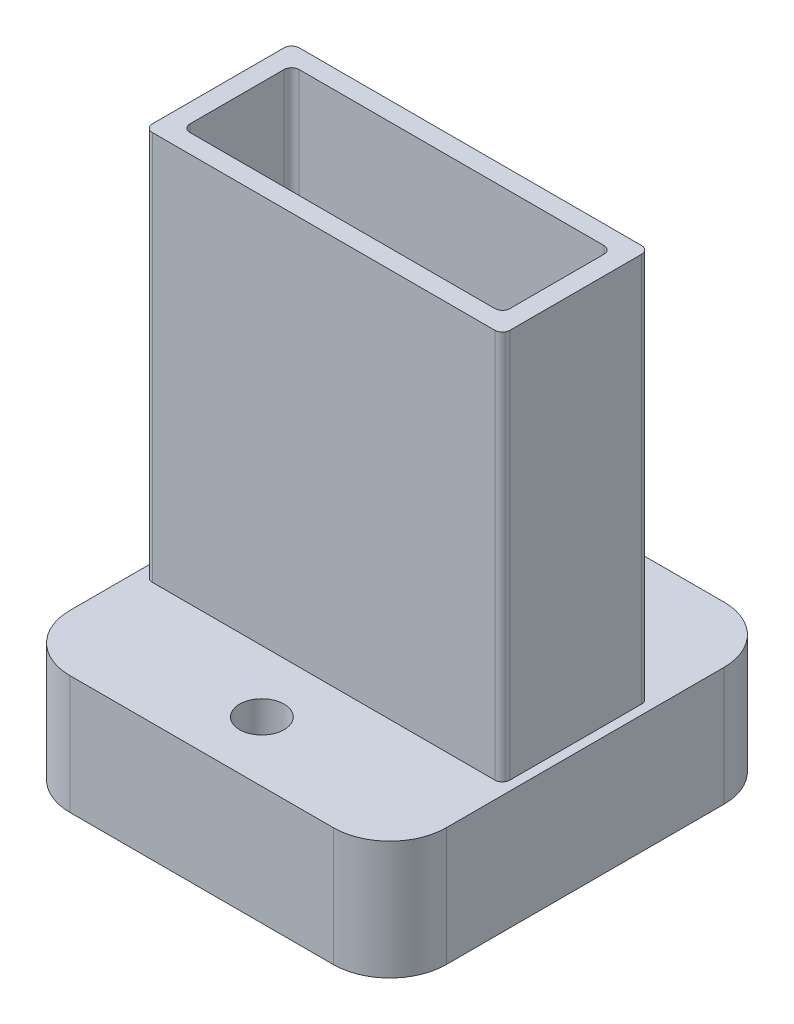
from build123d import *

# Parameters (mm, degrees)
BOSS_EXTRUDE1_DEPTH = 23.622
BOSS_EXTRUDE2_DEPTH = 10.668
SKETCH4_R           = 1.499997
BOSS_EXTRUDE3_DEPTH = 8


with BuildPart() as part:
    # Sketch1 → Boss-Extrude1 (new body)
    with BuildSketch(Plane(origin=(0, 0, 0), x_dir=(1, 0, 0), z_dir=(0, 1, 0))):
        with BuildLine():
            Line((11.557, 4.953), (-11.557, 4.953))
            ThreePointArc((-11.557, 4.953), (-11.916210245, 4.804210245), (-12.065, 4.445))
            Line((-12.065, 4.445), (-12.065, -4.445))
            ThreePointArc((-12.065, -4.445), (-11.916210245, -4.804210245), (-11.557, -4.953))
            Line((-11.557, -4.953), (11.557, -4.953))
            ThreePointArc((11.557, -4.953), (11.916210245, -4.804210245), (12.065, -4.445))
            Line((12.065, -4.445), (12.065, 4.445))
            ThreePointArc((12.065, 4.445), (11.916210245, 4.804210245), (11.557, 4.953))
        make_face()
    extrude(amount=BOSS_EXTRUDE1_DEPTH)

    # Sketch2 → Boss-Extrude2 (add)
    with BuildSketch(Plane(origin=(0, 23.622, 0), x_dir=(1, 0, 0), z_dir=(0, 1, 0))):
        with BuildLine():
            Line((11.557, 4.953), (-11.557, 4.953))
            ThreePointArc((-11.557, 4.953), (-11.916210245, 4.804210245), (-12.065, 4.445))
            Line((-12.065, 4.445), (-12.065, -4.445))
            ThreePointArc((-12.065, -4.445), (-11.916210245, -4.804210245), (-11.557, -4.953))
            Line((-11.557, -4.953), (11.557, -4.953))
            ThreePointArc((11.557, -4.953), (11.916210245, -4.804210245), (12.065, -4.445))
            Line((12.065, -4.445), (12.065, 4.445))
            ThreePointArc((12.065, 4.445), (11.916210245, 4.804210245), (11.557, 4.953))
        make_face()
        with BuildLine():
            Line((10.287, -3.683), (-10.287, -3.683))
            ThreePointArc((-10.287, -3.683), (-10.646210245, -3.534210245), (-10.795, -3.175))
            Line((-10.795, -3.175), (-10.795, 3.175))
            ThreePointArc((-10.795, 3.175), (-10.646210245, 3.534210245), (-10.287, 3.683))
            Line((-10.287, 3.683), (10.287, 3.683))
            ThreePointArc((10.287, 3.683), (10.646210245, 3.534210245), (10.795, 3.175))
            Line((10.795, 3.175), (10.795, -3.175))
            ThreePointArc((10.795, -3.175), (10.646210245, -3.534210245), (10.287, -3.683))
        make_face(mode=Mode.SUBTRACT)
    extrude(amount=BOSS_EXTRUDE2_DEPTH)

    # Sketch4 → Boss-Extrude3 (add)
    with BuildSketch(Plane(origin=(0, 0, 0), x_dir=(1, 0, 0), z_dir=(0, 1, 0))):
        with BuildLine():
            Line((-8.89, -13.184), (8.89, -13.184))
            ThreePointArc((8.89, -13.184), (11.584076836, -12.068076836), (12.7, -9.374))
            Line((12.7, -9.374), (12.7, 9.374))
            ThreePointArc((12.7, 9.374), (11.584076836, 12.068076836), (8.89, 13.184))
            Line((8.89, 13.184), (-8.89, 13.184))
            ThreePointArc((-8.89, 13.184), (-11.584076836, 12.068076836), (-12.7, 9.374))
            Line((-12.7, 9.374), (-12.7, -9.374))
            ThreePointArc((-12.7, -9.374), (-11.584076836, -12.068076836), (-8.89, -13.184))
        make_face()
        with Locations(Location((0, -9.12, 0), (0, 0, 270))):
            Circle(SKETCH4_R, mode=Mode.SUBTRACT)
        with Locations(Location((0, 9.12, 0), (0, 0, 90))):
            Circle(SKETCH4_R, mode=Mode.SUBTRACT)
    extrude(amount=BOSS_EXTRUDE3_DEPTH)


solid = part.part
